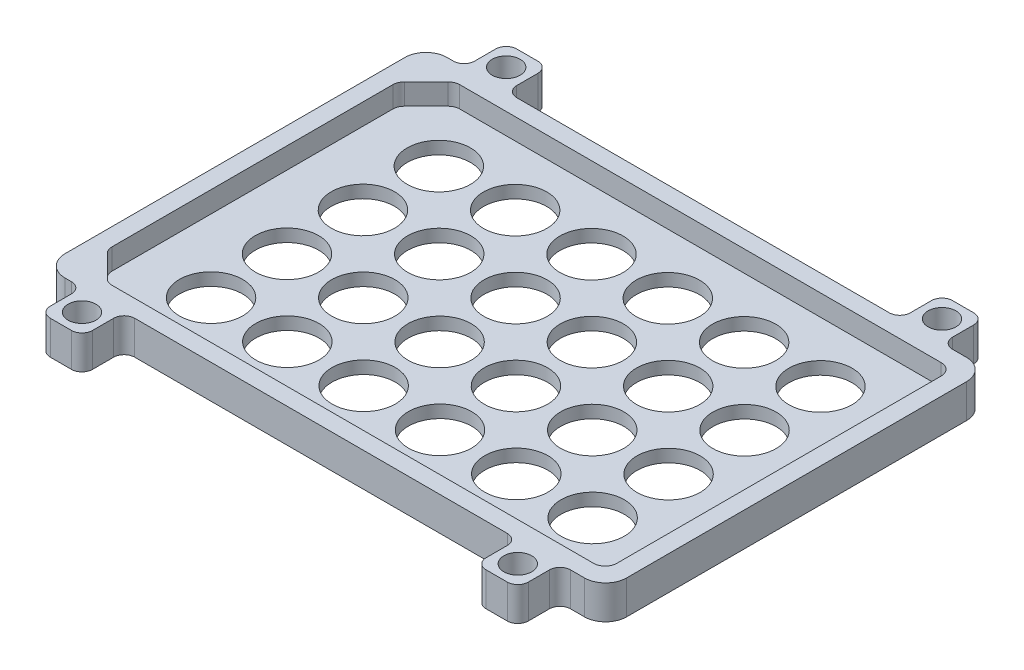
from build123d import *

# Parameters (mm, degrees)
SKETCH1_W            = 157.864
SKETCH1_H            = 90.551
BOSS_EXTRUDE1_DEPTH  = 8
CUT_EXTRUDE21_DEPTH  = 5
FILLET8_R            = 2.75
SKETCH29_W           = 12.37533
SKETCH29_H           = 90.551
CUT_EXTRUDE25_DEPTH  = 183.166204596
FILLET9_R            = 5
SKETCH36_W           = 10
SKETCH36_H           = 10
SKETCH36_R           = 3.3
BOSS_EXTRUDE10_DEPTH = 8
FILLET10_R           = 2.5
SKETCH37_R           = 7.5
CUT_EXTRUDE26_DEPTH  = 3


with BuildPart() as part:
    # Sketch1 → Boss-Extrude1 (new body)
    with BuildSketch(Plane(origin=(0, 0, 0), x_dir=(1, 0, 0), z_dir=(0, 1, 0))):
        with Locations((78.932, -45.2755)):
            Rectangle(SKETCH1_W, SKETCH1_H)
    extrude(amount=BOSS_EXTRUDE1_DEPTH)

    # Sketch23 → Cut-Extrude21 (cut)
    with BuildSketch(Plane(origin=(0, 8, 0), x_dir=(1, 0, 0), z_dir=(0, 1, 0))):
        Polygon((141.332, -86.4755), (23.3181173, -86.4755), (16.532, -79.6893827), (16.532, -10.8616173), (23.3181173, -4.0755), (141.332, -4.0755), align=None)
    extrude(amount=-CUT_EXTRUDE21_DEPTH, mode=Mode.SUBTRACT)

    # Fillet8
    fillet8_edges = [part.edges().sort_by_distance(p)[0] for p in [
        (141.332, 5.5, 4.0755),
        (141.332, 5.5, 86.4755),
        (23.3181173, 5.5, 86.4755),
        (16.532, 5.5, 79.6893827),
        (16.532, 5.5, 10.8616173),
        (23.3181173, 5.5, 4.0755),
    ]]
    fillet(fillet8_edges, radius=FILLET8_R)

    # Sketch29 → Cut-Extrude25 (cut, through all)
    with BuildSketch(Plane(origin=(0, 8, 0), x_dir=(1, 0, 0), z_dir=(0, 1, 0))):
        with Locations((151.676335, -45.2755)):
            Rectangle(SKETCH29_W, SKETCH29_H)
        with Locations((6.187665, -45.2755)):
            Rectangle(SKETCH29_W, SKETCH29_H)
    extrude(amount=-CUT_EXTRUDE25_DEPTH, mode=Mode.SUBTRACT)

    # Fillet9
    fillet9_edges = [part.edges().sort_by_distance(p)[0] for p in [
        (145.48867, 4, 90.551),
        (145.48867, 4, 0),
        (12.37533, 4, 0),
        (12.37533, 4, 90.551),
    ]]
    fillet(fillet9_edges, radius=FILLET9_R)

    # Sketch36 → Boss-Extrude10 (add)
    # profile 1 of 4: a face of its own
    with BuildSketch(Plane.XZ):
        with Locations((26.3936, 95.551)):
            Rectangle(SKETCH36_W, SKETCH36_H)
        with Locations(Location((26.3936, 95.551, 0), (0, 0, 270))):
            Circle(SKETCH36_R, mode=Mode.SUBTRACT)
    # profile 2 of 4: a face of its own
    with BuildSketch(Plane.XZ):
        with Locations((129.6936, 95.551)):
            Rectangle(SKETCH36_W, SKETCH36_H)
        with Locations(Location((129.6936, 95.551, 0), (0, 0, 270))):
            Circle(SKETCH36_R, mode=Mode.SUBTRACT)
    # profile 3 of 4: a face of its own
    with BuildSketch(Plane.XZ):
        with Locations((26.3936, -5)):
            Rectangle(SKETCH36_W, SKETCH36_H)
        with Locations(Location((26.3936, -5, 0), (0, 0, 270))):
            Circle(SKETCH36_R, mode=Mode.SUBTRACT)
    # profile 4 of 4: a face of its own
    with BuildSketch(Plane.XZ):
        with Locations((129.6936, -5)):
            Rectangle(SKETCH36_W, SKETCH36_H)
        with Locations(Location((129.6936, -5, 0), (0, 0, 270))):
            Circle(SKETCH36_R, mode=Mode.SUBTRACT)
    extrude(amount=-BOSS_EXTRUDE10_DEPTH)

    # Fillet10
    fillet10_edges = [part.edges().sort_by_distance(p)[0] for p in [
        (21.3936, 4, 90.551),
        (21.3936, 4, 100.551),
        (31.3936, 4, 100.551),
        (31.3936, 4, 90.551),
        (124.6936, 4, 90.551),
        (124.6936, 4, 100.551),
        (134.6936, 4, 100.551),
        (134.6936, 4, 90.551),
        (31.3936, 4, 0),
        (31.3936, 4, -10),
        (21.3936, 4, -10),
        (21.3936, 4, 0),
        (124.6936, 4, -10),
        (124.6936, 4, 0),
        (134.6936, 4, 0),
        (134.6936, 4, -10),
    ]]
    fillet(fillet10_edges, radius=FILLET10_R)

    # Sketch37 → Cut-Extrude26 (cut)
    with BuildSketch(Plane(origin=(0, 3, 0), x_dir=(1, 0, 0), z_dir=(0, 1, 0))):
        with Locations(Location((124.157, -72.2755, 0), (0, 0, 270))):
            Circle(SKETCH37_R)
        with Locations(Location((106.067, -72.2755, 0), (0, 0, 270))):
            Circle(SKETCH37_R)
        with Locations(Location((87.977, -72.2755, 0), (0, 0, 270))):
            Circle(SKETCH37_R)
        with Locations(Location((69.887, -72.2755, 0), (0, 0, 270))):
            Circle(SKETCH37_R)
        with Locations(Location((51.797, -72.2755, 0), (0, 0, 270))):
            Circle(SKETCH37_R)
        with Locations(Location((33.707, -72.2755, 0), (0, 0, 270))):
            Circle(SKETCH37_R)
        with Locations(Location((106.067, -54.2755, 0), (0, 0, 270))):
            Circle(SKETCH37_R)
        with Locations(Location((87.977, -54.2755, 0), (0, 0, 270))):
            Circle(SKETCH37_R)
        with Locations(Location((69.887, -54.2755, 0), (0, 0, 270))):
            Circle(SKETCH37_R)
        with Locations(Location((51.797, -54.2755, 0), (0, 0, 270))):
            Circle(SKETCH37_R)
        with Locations(Location((33.707, -54.2755, 0), (0, 0, 270))):
            Circle(SKETCH37_R)
        with Locations(Location((106.067, -36.2755, 0), (0, 0, 270))):
            Circle(SKETCH37_R)
        with Locations(Location((87.977, -36.2755, 0), (0, 0, 270))):
            Circle(SKETCH37_R)
        with Locations(Location((69.887, -36.2755, 0), (0, 0, 270))):
            Circle(SKETCH37_R)
        with Locations(Location((51.797, -36.2755, 0), (0, 0, 270))):
            Circle(SKETCH37_R)
        with Locations(Location((33.707, -36.2755, 0), (0, 0, 270))):
            Circle(SKETCH37_R)
        with Locations(Location((106.067, -18.2755, 0), (0, 0, 270))):
            Circle(SKETCH37_R)
        with Locations(Location((87.977, -18.2755, 0), (0, 0, 270))):
            Circle(SKETCH37_R)
        with Locations(Location((69.887, -18.2755, 0), (0, 0, 270))):
            Circle(SKETCH37_R)
        with Locations(Location((51.797, -18.2755, 0), (0, 0, 270))):
            Circle(SKETCH37_R)
        with Locations(Location((33.707, -18.2755, 0), (0, 0, 270))):
            Circle(SKETCH37_R)
        with Locations(Location((124.157, -54.2755, 0), (0, 0, 270))):
            Circle(SKETCH37_R)
        with Locations(Location((124.157, -36.2755, 0), (0, 0, 270))):
            Circle(SKETCH37_R)
        with Locations(Location((124.157, -18.2755, 0), (0, 0, 270))):
            Circle(SKETCH37_R)
    extrude(amount=-CUT_EXTRUDE26_DEPTH, mode=Mode.SUBTRACT)


solid = part.part
